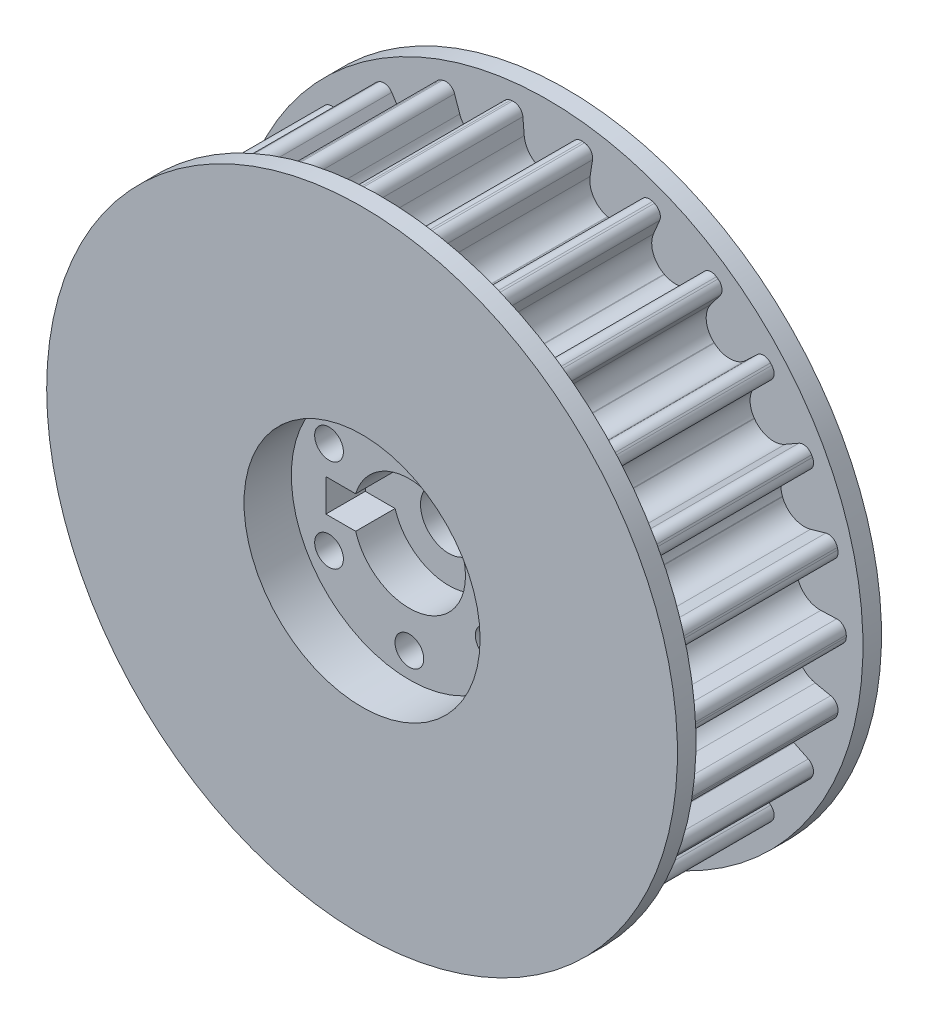
from build123d import *

# Parameters (mm, degrees)
SKETCH1_R                = 32.2
BOSS_EXTRUDE1_DEPTH      = 9
CUT_EXTRUDE2_REACH       = 50.966
FILLET1_R                = 2.5
FILLET2_R                = 1
CIRPATTERN1_COUNT        = 26
FILLET1_OF_CIRPATTERN1_R = 2.5
FILLET2_OF_CIRPATTERN1_R = 1
SKETCH3_R                = 34
BOSS_EXTRUDE2_DEPTH      = 2
SKETCH4_R                = 12.725
CUT_EXTRUDE3_DEPTH       = 5.1
SKETCH5_R                = 6.05
CUT_EXTRUDE4_DEPTH       = 9.35
SKETCH6_R                = 3.05
CUT_EXTRUDE5_DEPTH       = 53.877216266
SKETCH7_R                = 1.55
CUT_EXTRUDE6_DEPTH       = 53.877216266
CIRPATTERN2_COUNT        = 6
SKETCH8_W                = 9
SKETCH8_H                = 3.5
CUT_EXTRUDE7_DEPTH       = 9.35


with BuildPart() as part:
    # Sketch1 → Boss-Extrude1 (new, symmetric)
    with BuildSketch(Plane.XY):
        Circle(SKETCH1_R)
    extrude(amount=BOSS_EXTRUDE1_DEPTH, both=True)

    # Sketch2 → Cut-Extrude2 (cut, up to next)
    with BuildSketch(Plane.XY.offset(9), mode=Mode.PRIVATE) as cut_extrude2_sk1:
        with BuildLine():
            Line((-2.75, 32.082354963), (-2.321415502, 27.082354963))
            Line((-2.321415502, 27.082354963), (2.321415502, 27.082354963))
            Line((2.321415502, 27.082354963), (2.75, 32.082354963))
            ThreePointArc((2.75, 32.082354963), (0, 35.078160605), (-2.75, 32.082354963))
        make_face()
    cut_extrude2_tool1 = extrude(cut_extrude2_sk1.sketch, amount=-CUT_EXTRUDE2_REACH, mode=Mode.PRIVATE) & part.part
    cut_extrude2 = cut_extrude2_tool1.solids().sort_by_distance((0, 30.927212, 9))[0]
    add(cut_extrude2, mode=Mode.SUBTRACT)

    # Fillet1
    fillet1_edges = [part.edges().sort_by_distance(p)[0] for p in [
        (2.321415502, 27.082354963, 0),
        (-2.321415502, 27.082354963, 0),
    ]]
    fillet(fillet1_edges, radius=FILLET1_R)

    # Fillet2
    fillet2_edges = [part.edges().sort_by_distance(p)[0] for p in [
        (2.75, 32.082354963, 0),
        (-2.75, 32.082354963, 0),
    ]]
    fillet(fillet2_edges, radius=FILLET2_R)

    # CirPattern1: Cut-Extrude2 ×26 about axis
    cirpattern1_axis = Axis((0, 0, 0), (0, 0, 1))
    for i in range(1, CIRPATTERN1_COUNT):
        add(cut_extrude2.rotate(cirpattern1_axis, i * 360 / CIRPATTERN1_COUNT), mode=Mode.SUBTRACT)

    # Fillet1 of CirPattern1
    fillet1_of_cirpattern1_edges = [part.edges().sort_by_distance(p)[0] for p in [
        (-4.227272382, 26.850942041, 0),
        (-8.735191155, 25.739839855, 0),
        (-10.530286561, 25.059049967, 0),
        (-14.641309249, 22.901418816, 0),
        (-16.221318761, 21.810816994, 0),
        (-19.696527669, 18.732050557, 0),
        (-20.969626876, 17.295018617, 0),
        (-23.607055494, 13.474043609, 0),
        (-24.499256499, 11.774096623, 0),
        (-26.145627063, 7.432974222, 0),
        (-26.605078386, 5.56890693, 0),
        (-27.164709822, 0.959927392, 0),
        (-27.164709822, -0.959927392, 0),
        (-26.605078386, -5.56890693, 0),
        (-26.145627063, -7.432974222, 0),
        (-24.499256499, -11.774096623, 0),
        (-23.607055494, -13.474043609, 0),
        (-20.969626876, -17.295018617, 0),
        (-19.696527669, -18.732050557, 0),
        (-16.221318761, -21.810816994, 0),
        (-14.641309249, -22.901418816, 0),
        (-10.530286561, -25.059049967, 0),
        (-8.735191155, -25.739839855, 0),
        (-4.227272382, -26.850942041, 0),
        (-2.321415502, -27.082354963, 0),
        (2.321415502, -27.082354963, 0),
        (4.227272382, -26.850942041, 0),
        (8.735191155, -25.739839855, 0),
        (10.530286561, -25.059049967, 0),
        (14.641309249, -22.901418816, 0),
        (16.221318761, -21.810816994, 0),
        (19.696527669, -18.732050557, 0),
        (20.969626876, -17.295018617, 0),
        (23.607055494, -13.474043609, 0),
        (24.499256499, -11.774096623, 0),
        (26.145627063, -7.432974222, 0),
        (26.605078386, -5.56890693, 0),
        (27.164709822, -0.959927392, 0),
        (27.164709822, 0.959927392, 0),
        (26.605078386, 5.56890693, 0),
        (26.145627063, 7.432974222, 0),
        (24.499256499, 11.774096623, 0),
        (23.607055494, 13.474043609, 0),
        (20.969626876, 17.295018617, 0),
        (19.696527669, 18.732050557, 0),
        (16.221318761, 21.810816994, 0),
        (14.641309249, 22.901418816, 0),
        (10.530286561, 25.059049967, 0),
        (8.735191155, 25.739839855, 0),
        (4.227272382, 26.850942041, 0),
    ]]
    fillet(fillet1_of_cirpattern1_edges, radius=FILLET1_OF_CIRPATTERN1_R)

    # Fillet2 of CirPattern1
    fillet2_of_cirpattern1_edges = [part.edges().sort_by_distance(p)[0] for p in [
        (-5.007720092, 31.808218112, 0),
        (-10.347900088, 30.491981959, 0),
        (-12.474409695, 29.685503243, 0),
        (-17.344417836, 27.129525796, 0),
        (-19.216131949, 25.837574827, 0),
        (-23.332941063, 22.190400207, 0),
        (-24.841082461, 20.488060478, 0),
        (-27.965438568, 15.961649216, 0),
        (-29.022359555, 13.947854525, 0),
        (-30.972686434, 8.80526519, 0),
        (-31.516962603, 6.597049966, 0),
        (-32.179914345, 1.137151158, 0),
        (-32.179914345, -1.137151158, 0),
        (-31.516962603, -6.597049966, 0),
        (-30.972686434, -8.80526519, 0),
        (-29.022359555, -13.947854525, 0),
        (-27.965438568, -15.961649216, 0),
        (-24.841082461, -20.488060478, 0),
        (-23.332941063, -22.190400207, 0),
        (-19.216131949, -25.837574827, 0),
        (-17.344417836, -27.129525796, 0),
        (-12.474409695, -29.685503243, 0),
        (-10.347900088, -30.491981959, 0),
        (-5.007720092, -31.808218112, 0),
        (-2.75, -32.082354963, 0),
        (2.75, -32.082354963, 0),
        (5.007720092, -31.808218112, 0),
        (10.347900088, -30.491981959, 0),
        (12.474409695, -29.685503243, 0),
        (17.344417836, -27.129525796, 0),
        (19.216131949, -25.837574827, 0),
        (23.332941063, -22.190400207, 0),
        (24.841082461, -20.488060478, 0),
        (27.965438568, -15.961649216, 0),
        (29.022359555, -13.947854525, 0),
        (30.972686434, -8.80526519, 0),
        (31.516962603, -6.597049966, 0),
        (32.179914345, -1.137151158, 0),
        (32.179914345, 1.137151158, 0),
        (31.516962603, 6.597049966, 0),
        (30.972686434, 8.80526519, 0),
        (29.022359555, 13.947854525, 0),
        (27.965438568, 15.961649216, 0),
        (24.841082461, 20.488060478, 0),
        (23.332941063, 22.190400207, 0),
        (19.216131949, 25.837574827, 0),
        (17.344417836, 27.129525796, 0),
        (12.474409695, 29.685503243, 0),
        (10.347900088, 30.491981959, 0),
        (5.007720092, 31.808218112, 0),
    ]]
    fillet(fillet2_of_cirpattern1_edges, radius=FILLET2_OF_CIRPATTERN1_R)

    # Sketch3 → Boss-Extrude2 (add)
    with BuildSketch(Plane(origin=(0, 0, -9), x_dir=(-1, 0, 0), z_dir=(0, 0, -1))):
        Circle(SKETCH3_R)
    boss_extrude2 = extrude(amount=BOSS_EXTRUDE2_DEPTH)

    # Mirror1: Boss-Extrude2 across plane
    add(boss_extrude2.mirror(Plane.XY))

    # Sketch4 → Cut-Extrude3 (cut)
    with BuildSketch(Plane.XY.offset(11)):
        Circle(SKETCH4_R)
    extrude(amount=-CUT_EXTRUDE3_DEPTH, mode=Mode.SUBTRACT)

    # Sketch5 → Cut-Extrude4 (cut)
    with BuildSketch(Plane.XY.offset(11)):
        Circle(SKETCH5_R)
    extrude(amount=-CUT_EXTRUDE4_DEPTH, mode=Mode.SUBTRACT)

    # Sketch6 → Cut-Extrude5 (cut, through all)
    with BuildSketch(Plane.XY.offset(11)):
        Circle(SKETCH6_R)
    extrude(amount=-CUT_EXTRUDE5_DEPTH, mode=Mode.SUBTRACT)

    # Sketch7 → Cut-Extrude6 (cut, through all)
    with BuildSketch(Plane.XY.offset(11)):
        with Locations((0, 10)):
            Circle(SKETCH7_R)
    cut_extrude6 = extrude(amount=-CUT_EXTRUDE6_DEPTH, mode=Mode.SUBTRACT)

    # CirPattern2: Cut-Extrude6 ×6 about axis
    cirpattern2_axis = Axis((0, 0, 0), (0, 0, 1))
    for i in range(1, CIRPATTERN2_COUNT):
        add(cut_extrude6.rotate(cirpattern2_axis, i * 360 / CIRPATTERN2_COUNT), mode=Mode.SUBTRACT)

    # Sketch8 → Cut-Extrude7 (cut)
    with BuildSketch(Plane.XY.offset(11)):
        with Locations((-4.5, 0)):
            Rectangle(SKETCH8_W, SKETCH8_H)
    extrude(amount=-CUT_EXTRUDE7_DEPTH, mode=Mode.SUBTRACT)


solid = part.part
